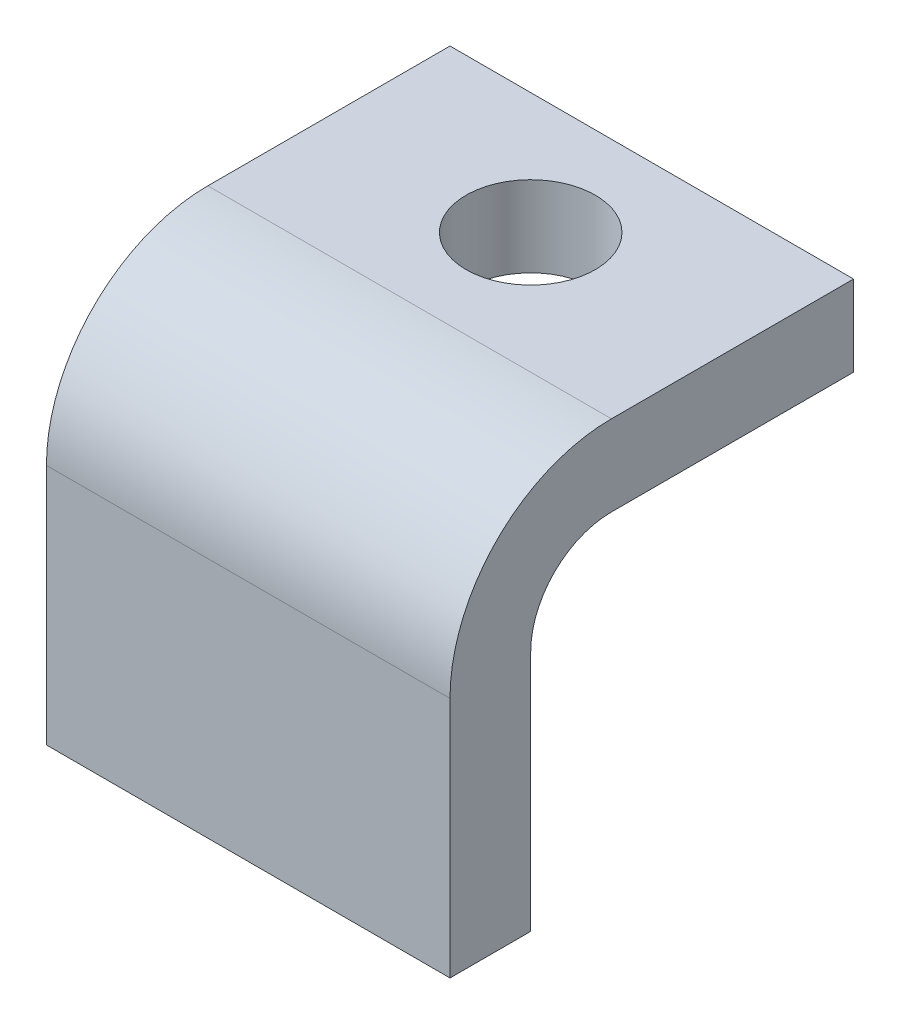
from build123d import *

# Parameters (mm, degrees)
EXTRUDE_1_DEPTH    = 5
HOLE_WIZARD_M3_1_D = 3.2


with BuildPart() as part:
    # 草图1 → 拉伸-薄壁1 (new, symmetric)
    with BuildSketch(Plane(origin=(0, 0, 0), x_dir=(0, 0, -1), z_dir=(1, 0, 0))):
        with BuildLine():
            Line((0, 0), (0, 6))
            ThreePointArc((0, 6), (1.171572875, 8.828427125), (4, 10))
            Line((4, 10), (10, 10))
            Line((10, 10), (10, 8))
            Line((10, 8), (4, 8))
            ThreePointArc((4, 8), (2.585786438, 7.414213562), (2, 6))
            Line((2, 6), (2, 0))
            Line((2, 0), (0, 0))
        make_face()
    extrude(amount=EXTRUDE_1_DEPTH, both=True)

    # M3 间隙孔1 (through all)
    with Locations(Plane(origin=(0, 10, 0), x_dir=(1, 0, 0), z_dir=(0, 1, 0))):
        with Locations((0, 7)):
            Hole(HOLE_WIZARD_M3_1_D / 2)


solid = part.part
